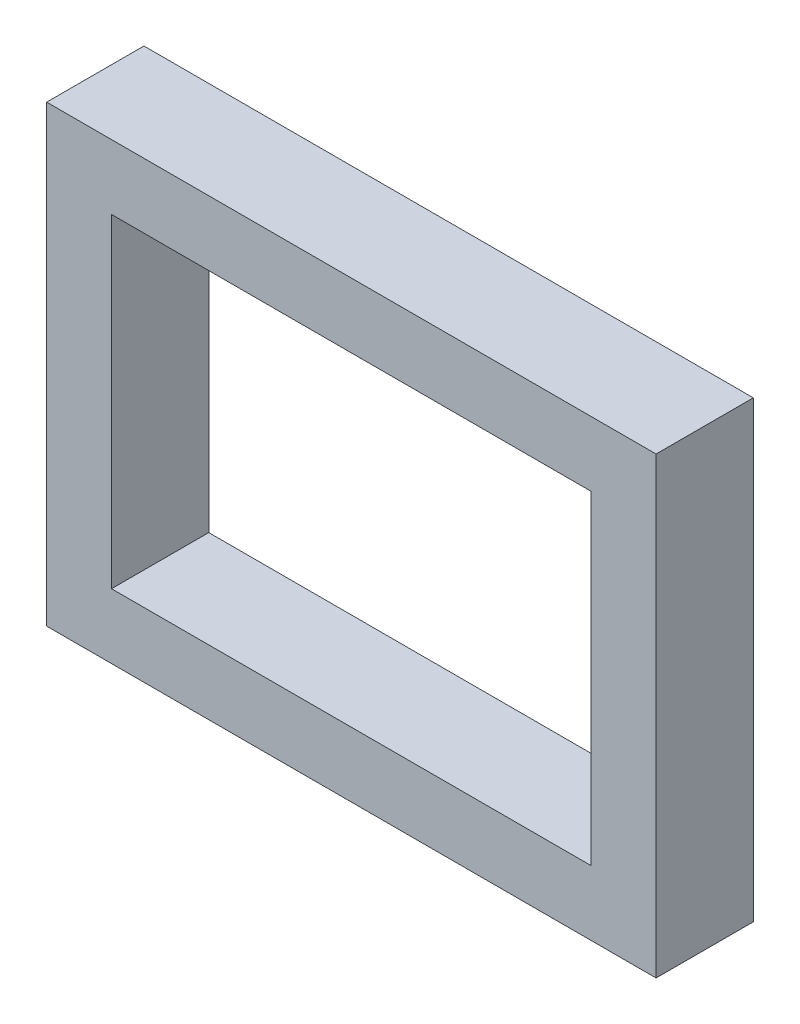
from build123d import *

# Parameters (mm, degrees)
SKETCH1_W           = 59.69
SKETCH1_H           = 44.45
SKETCH1_W_2         = 46.99
SKETCH1_H_2         = 31.75
BOSS_EXTRUDE1_DEPTH = 9.525


with BuildPart() as part:
    # Sketch1 → Boss-Extrude1 (new body)
    with BuildSketch(Plane.XY):
        Rectangle(SKETCH1_W, SKETCH1_H)
        Rectangle(SKETCH1_W_2, SKETCH1_H_2, mode=Mode.SUBTRACT)
    extrude(amount=BOSS_EXTRUDE1_DEPTH)


solid = part.part
